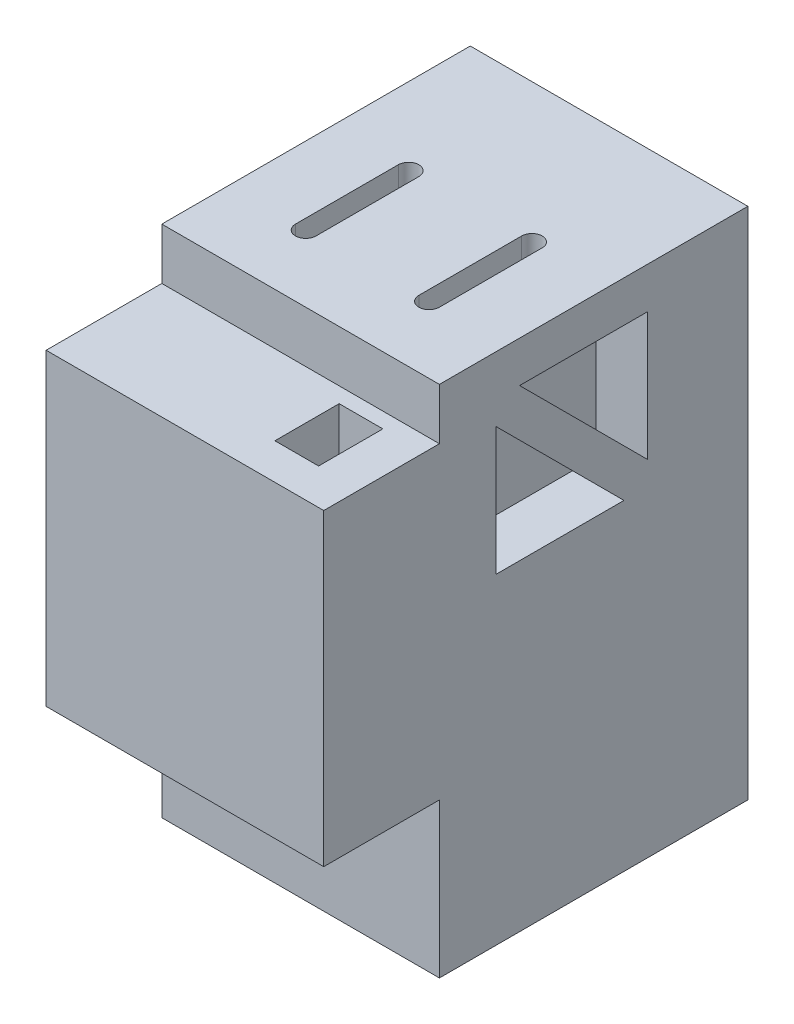
from build123d import *

# Parameters (mm, degrees)
SKETCH_1_W          = 54
SKETCH_1_H          = 100
EXTRUDE_1_DEPTH     = 60
SKETCH_2_W          = 54
SKETCH_2_H          = 60
EXTRUDE_2_DEPTH     = 22.5
SKETCH_3_W          = 8.5
SKETCH_3_H          = 12.5
CUT_EXTRUDE_1_DEPTH = 22.5
CUT_EXTRUDE_2_DEPTH = 10
CUT_EXTRUDE_3_DEPTH = 10


with BuildPart() as part:
    # 草图1 → 凸台-拉伸1 (new body)
    with BuildSketch(Plane.XY):
        with Locations((-27, -50)):
            Rectangle(SKETCH_1_W, SKETCH_1_H)
    extrude(amount=EXTRUDE_1_DEPTH)

    # 草图2 → 凸台-拉伸2 (add)
    with BuildSketch(Plane.XY.offset(60)):
        with Locations((-27, -40)):
            Rectangle(SKETCH_2_W, SKETCH_2_H)
    extrude(amount=EXTRUDE_2_DEPTH)

    # 草图3 → 切除-拉伸1 (cut)
    with BuildSketch(Plane(origin=(0, -10, 0), x_dir=(1, 0, 0), z_dir=(0, 1, 0))):
        with Locations((-12.25, -69.25)):
            Rectangle(SKETCH_3_W, SKETCH_3_H)
    extrude(amount=-CUT_EXTRUDE_1_DEPTH, mode=Mode.SUBTRACT)

    # 草图4 → 切除-拉伸2 (cut)
    with BuildSketch(Plane(origin=(0, 0, 0), x_dir=(1, 0, 0), z_dir=(0, 1, 0))):
        with BuildLine():
            Line((-37, -27), (-37, -47))
            ThreePointArc((-37, -47), (-39, -49), (-41, -47))
            Line((-41, -47), (-41, -27))
            ThreePointArc((-41, -27), (-39, -25), (-37, -27))
        make_face()
        with BuildLine():
            Line((-17, -27), (-17, -47))
            ThreePointArc((-17, -47), (-15, -49), (-13, -47))
            Line((-13, -47), (-13, -27))
            ThreePointArc((-13, -27), (-15, -25), (-17, -27))
        make_face()
    extrude(amount=-CUT_EXTRUDE_2_DEPTH, mode=Mode.SUBTRACT)

    # 草图5 → 切除-拉伸3 (cut)
    with BuildSketch(Plane(origin=(0, 0, 0), x_dir=(0, 0, -1), z_dir=(1, 0, 0))):
        Polygon((-44.403805922, -8), (-19.5, -8), (-19.5, -32.903805922), align=None)
        Polygon((-24.096194078, -37.5), (-49, -12.596194078), (-49, -37.5), align=None)
    extrude(amount=-CUT_EXTRUDE_3_DEPTH, mode=Mode.SUBTRACT)


solid = part.part
